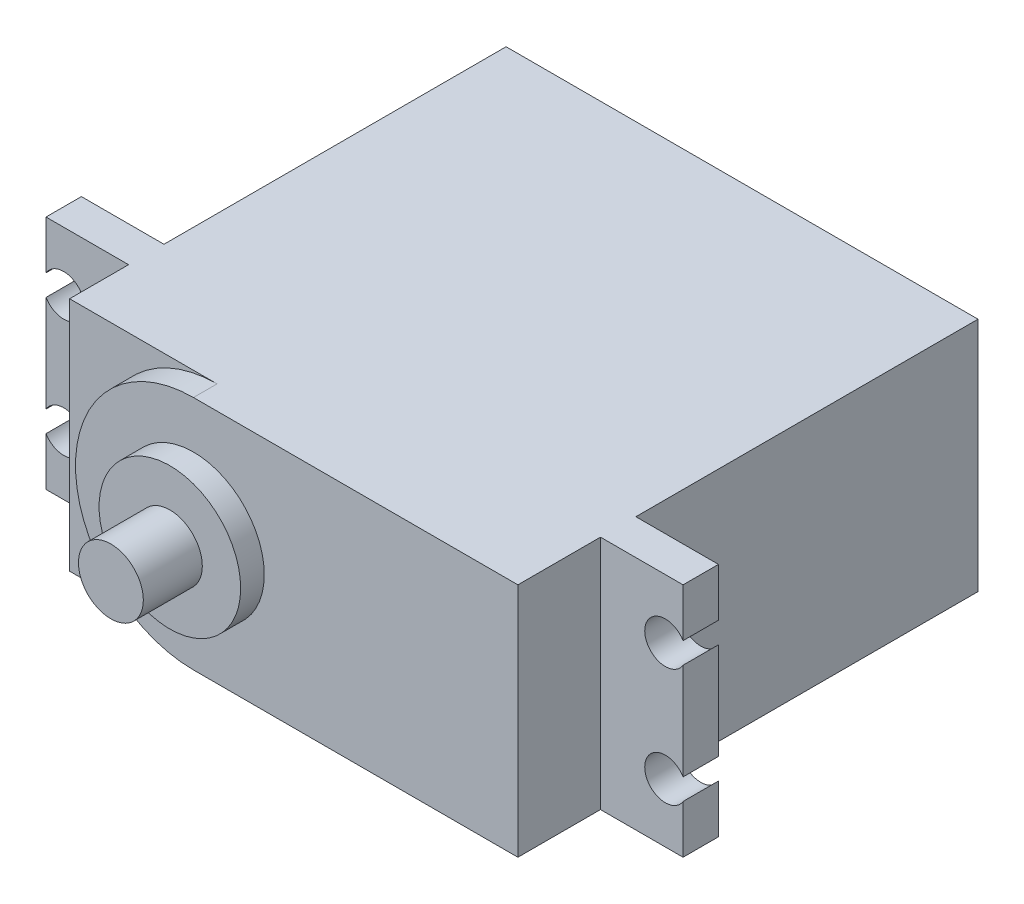
from build123d import *

# Parameters (mm, degrees)
SKETCH1_W           = 40
SKETCH1_H           = 20
BOSS_EXTRUDE1_DEPTH = 37
BOSS_EXTRUDE2_DEPTH = 2
SKETCH3_R           = 6
BOSS_EXTRUDE3_DEPTH = 2
SKETCH4_R           = 2.75
BOSS_EXTRUDE4_DEPTH = 5
SKETCH5_W           = 7
SKETCH5_H           = 20
BOSS_EXTRUDE5_DEPTH = 3
SKETCH7_R           = 1.75
CUT_EXTRUDE3_DEPTH  = 44.0464865


with BuildPart() as part:
    # Sketch1 → Boss-Extrude1 (new body)
    with BuildSketch(Plane.XY):
        Rectangle(SKETCH1_W, SKETCH1_H)
    extrude(amount=BOSS_EXTRUDE1_DEPTH)

    # Sketch2 → Boss-Extrude2 (add)
    with BuildSketch(Plane.XY.offset(37)):
        with BuildLine():
            Line((-7.5, 10), (20, 10))
            Line((20, 10), (20, -10))
            Line((20, -10), (-7.5, -10))
            ThreePointArc((-7.5, -10), (-17.5, 0), (-7.5, 10))
        make_face()
    extrude(amount=BOSS_EXTRUDE2_DEPTH)

    # Sketch3 → Boss-Extrude3 (add)
    with BuildSketch(Plane.XY.offset(39)):
        with Locations((-7.5, 0)):
            Circle(SKETCH3_R)
    extrude(amount=BOSS_EXTRUDE3_DEPTH)

    # Sketch4 → Boss-Extrude4 (add)
    with BuildSketch(Plane.XY.offset(41)):
        with Locations((-7.5, 0)):
            Circle(SKETCH4_R)
    extrude(amount=BOSS_EXTRUDE4_DEPTH)

    # Sketch5 → Boss-Extrude5 (add)
    with BuildSketch(Plane.XY.offset(32)):
        with Locations((-23.5, 0)):
            Rectangle(SKETCH5_W, SKETCH5_H)
        with Locations((23.5, 0)):
            Rectangle(SKETCH5_W, SKETCH5_H)
    extrude(amount=-BOSS_EXTRUDE5_DEPTH)

    # Sketch7 → Cut-Extrude3 (cut, through all)
    with BuildSketch(Plane.XY.offset(32)):
        with Locations((-25.5, 5)):
            Circle(SKETCH7_R)
        with Locations((-25.5, -5)):
            Circle(SKETCH7_R)
        with Locations((25.5, -5)):
            Circle(SKETCH7_R)
        with Locations((25.5, 5)):
            Circle(SKETCH7_R)
    extrude(amount=-CUT_EXTRUDE3_DEPTH, mode=Mode.SUBTRACT)


solid = part.part
